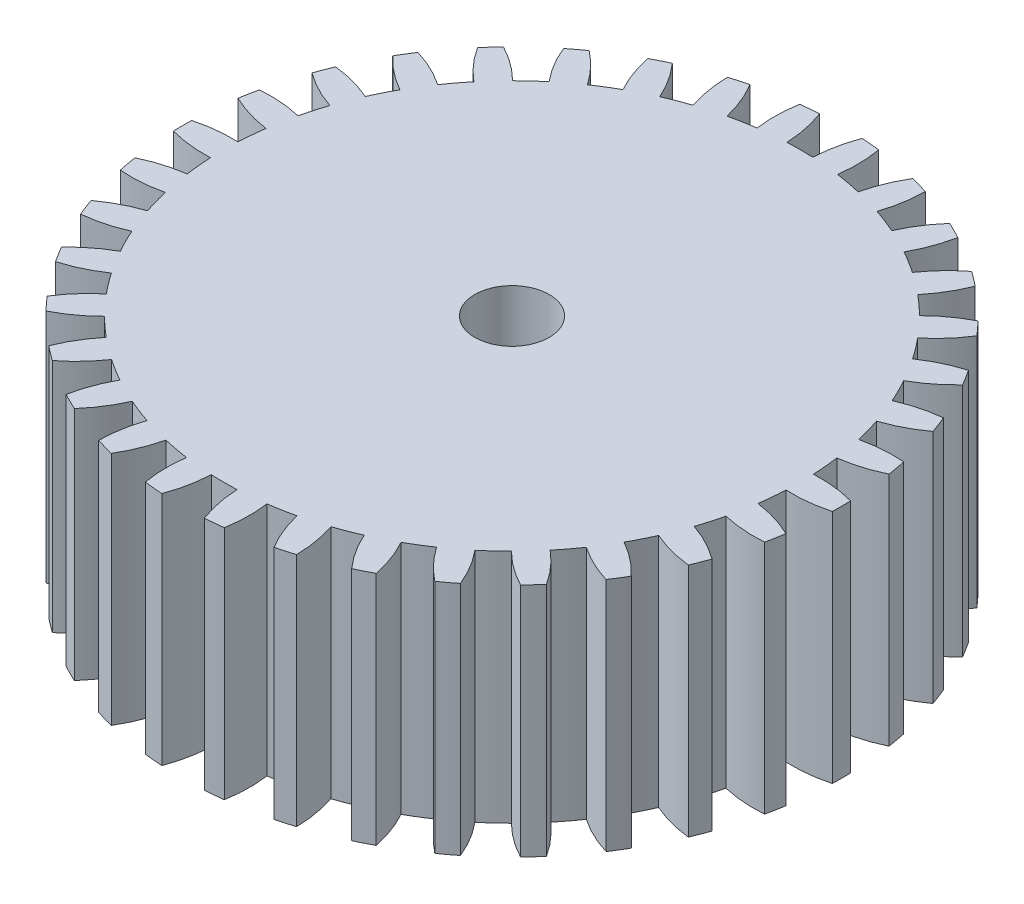
from build123d import *

# Parameters (mm, degrees)
SKETCH1_R               = 13.5001
BOSS_EXTRUDE1_DEPTH     = 9.652
CUT_EXTRUDE1_DEPTH      = 22.393141518
CUT_EXTRUDE2_DEPTH      = 22.393141518
CUT_EXTRUDE2_DEPTH_BACK = 22.393141518
SKETCH3_R               = 1.524
CIRPATTERN1_COUNT       = 34


with BuildPart() as part:
    # Sketch1 → Boss-Extrude1 (new body)
    with BuildSketch(Plane(origin=(0, 0, 0), x_dir=(1, 0, 0), z_dir=(0, 1, 0))):
        with Locations(Location((0, 0, 0), (0, 0, 270))):
            Circle(SKETCH1_R)
    extrude(amount=BOSS_EXTRUDE1_DEPTH)

    # Sketch2 → Cut-Extrude1 (cut, symmetric)
    with BuildSketch(Plane(origin=(0, 9.652, 0), x_dir=(1, 0, 0), z_dir=(0, 1, 0))):
        with BuildLine():
            Line((1.117288627, 14.032195245), (-1.117288627, 14.032195245))
            ThreePointArc((-1.117288627, 14.032195245), (-0.703588518, 12.942376626), (-0.528470774, 11.789907027))
            ThreePointArc((-0.528470774, 11.789907027), (0, 11.80174517), (0.528470774, 11.789907027))
            ThreePointArc((0.528470774, 11.789907027), (0.703588518, 12.942376626), (1.117288627, 14.032195245))
        make_face()
    cut_extrude1 = extrude(amount=CUT_EXTRUDE1_DEPTH, both=True, mode=Mode.SUBTRACT)

    # Sketch3 → Cut-Extrude2 (cut, two sides: drawn at the far end of the back side and taken through both)
    with BuildSketch(Plane(origin=(0, 0, 0), x_dir=(1, 0, 0), z_dir=(0, 1, 0)).offset(-CUT_EXTRUDE2_DEPTH_BACK)):
        with Locations(Location((0, 0, 0), (0, 0, 270))):
            Circle(SKETCH3_R)
    extrude(amount=CUT_EXTRUDE2_DEPTH + CUT_EXTRUDE2_DEPTH_BACK, mode=Mode.SUBTRACT)

    # CirPattern1: Cut-Extrude1 ×34 about axis
    cirpattern1_axis = Axis((0, 0, 0), (0, 1, 0))
    for i in range(1, CIRPATTERN1_COUNT):
        add(cut_extrude1.rotate(cirpattern1_axis, i * 360 / CIRPATTERN1_COUNT), mode=Mode.SUBTRACT)


solid = part.part
